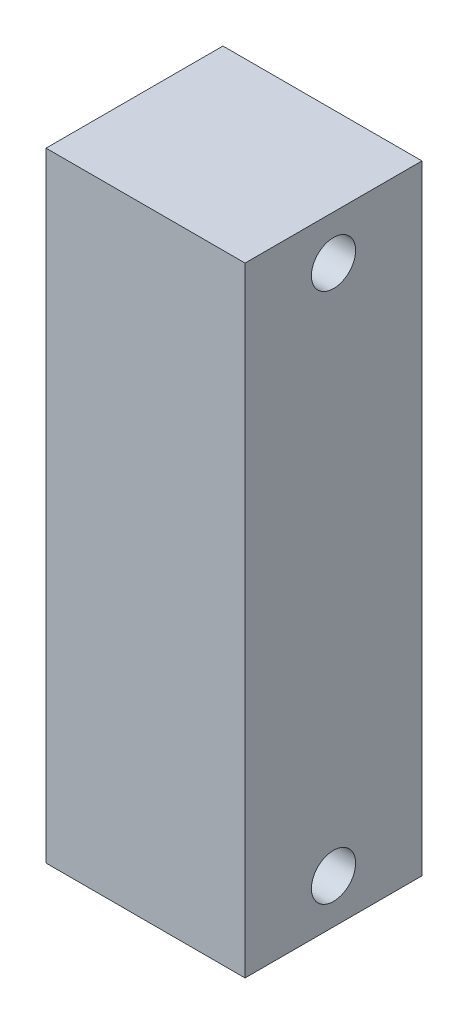
from build123d import *

# Parameters (mm, degrees)
SKETCH1_W           = 45
SKETCH1_H           = 40
BOSS_EXTRUDE1_DEPTH = 140
SKETCH2_R           = 5
CUT_EXTRUDE1_DEPTH  = 45


with BuildPart() as part:
    # Sketch1 → Boss-Extrude1 (new body)
    with BuildSketch(Plane(origin=(0, 0, 0), x_dir=(1, 0, 0), z_dir=(0, 1, 0))):
        Rectangle(SKETCH1_W, SKETCH1_H)
    extrude(amount=BOSS_EXTRUDE1_DEPTH)

    # Sketch2 → Cut-Extrude1 (cut)
    with BuildSketch(Plane(origin=(22.5, 0, 0), x_dir=(0, 0, -1), z_dir=(1, 0, 0))):
        with Locations((0, 130)):
            Circle(SKETCH2_R)
        with Locations((0, 10)):
            Circle(SKETCH2_R)
    extrude(amount=-CUT_EXTRUDE1_DEPTH, mode=Mode.SUBTRACT)


solid = part.part
